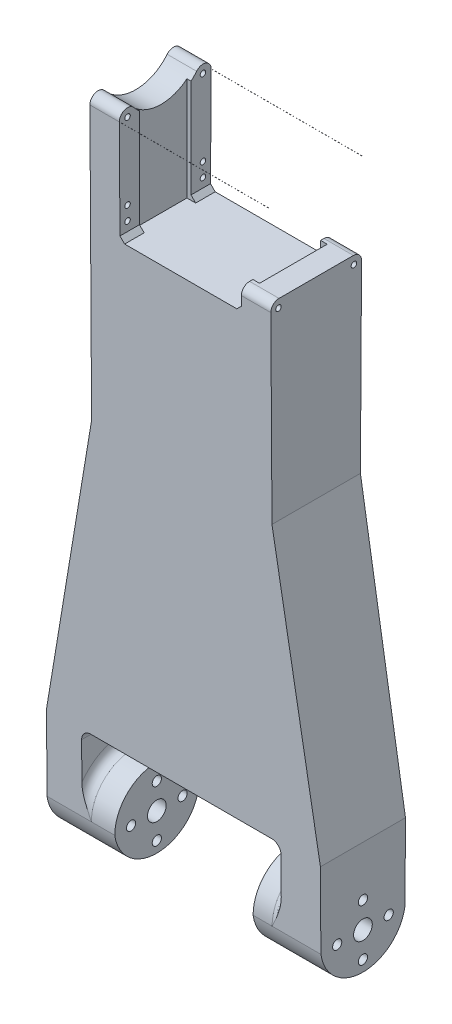
from build123d import *

# Parameters (mm, degrees)
BOSS_EXTRUDE1_DEPTH             = 24.511
BOSS_EXTRUDE1_DEPTH_BACK        = 24.511
CUT_EXTRUDE3_DEPTH              = 212.61733137029668
CUT_EXTRUDE3_DEPTH_BACK         = 212.61733137029668
SKETCH3_4_R                     = 1.250061000000001
SKETCH3_4_R_2                   = 1.2500610000000008
SKETCH3_4_R_3                   = 0.7500620000000013
SKETCH3_4_R_4                   = 0.7500620000000047
SKETCH3_4_R_5                   = 0.7500620000000029
SKETCH3_4_R_6                   = 2.5400000000000005
CUT_EXTRUDE4_DEPTH              = 18.796
CUT_EXTRUDE4_DEPTH_BACK         = 18.796
CUT_EXTRUDE5_DEPTH              = 16.51
CUT_EXTRUDE5_DEPTH_BACK         = 16.51
SKETCH4_4_W                     = 24.944915852009693
SKETCH4_4_H                     = 29.122471599999187
CUT_EXTRUDE6_DEPTH              = 18.200001699999998
CUT_EXTRUDE7_DEPTH              = 1.7999963999999997
CUT_EXTRUDE8_DEPTH              = 1.0999978
CUT_EXTRUDE10_DEPTH             = 212.61733137029668
CUT_EXTRUDE10_DEPTH_BACK        = 212.61733137029668
SKETCH7_R                       = 1.2500610000000012
SKETCH7_R_2                     = 1.2500610000000008
SKETCH7_R_3                     = 2.540000000000001
BOSS_EXTRUDE2_DEPTH             = 12.7
SKETCH8_W                       = 37.592
SKETCH8_H                       = 6.349999999999998
CUT_EXTRUDE11_DEPTH             = 8.093114
CUT_EXTRUDE12_DEPTH             = 45.289978
CUT_EXTRUDE12_DEPTH_BACK        = 8.889999999999999
BOSS_EXTRUDE8_REACH             = 215.461
BOSS_EXTRUDE8_DIRECTION_2_REACH = 215.461
FILLET2_R                       = 2.54
SKETCH15_R                      = 0.7500620000000063
CUT_EXTRUDE13_DEPTH             = 220.06782308598028
CUT_EXTRUDE14_DEPTH             = 10.922000000000002
CUT_EXTRUDE14_DEPTH_BACK        = 13.97
SKETCH16_W                      = 8.000999999999998
SKETCH16_H                      = 24.944915852009693
FILLET3_R                       = 2.2224999999999997
CUT_EXTRUDE16_DEPTH             = 1.3129259999999998
SKETCH18_W                      = 1.7999963999999977
SKETCH18_H                      = 18.39999999999989
CUT_EXTRUDE17_DEPTH             = 1.714821389
CHAMFER1_SIZE                   = 1.27


with BuildPart() as part:
    # Sketch3 → Boss-Extrude1 (new, two sides: drawn at the far end of the back side and taken through both)
    with BuildSketch(Plane(origin=(0, 0, 0), x_dir=(0, 0, -1), z_dir=(1, 0, 0)).offset(-BOSS_EXTRUDE1_DEPTH_BACK)):
        with BuildLine():
            Line((-11.429783892027034, 38.029713574858185), (-12.472457926005259, 207.58647868496024))
            ThreePointArc((-12.472457926005259, 207.58647868496024), (-10.998297041817699, 209.69288477315203), (-8.52275746267989, 208.99876611401845))
            ThreePointArc((-8.52275746267989, 208.99876611401845), (4.7735e-13, 204.93348624599832), (8.52275746267989, 208.99876611401845))
            ThreePointArc((8.52275746267989, 208.99876611401845), (10.9982970418177, 209.69288477315203), (12.472457926005257, 207.58647868496024))
            Line((12.472457926005257, 207.58647868496024), (11.429783892027034, 38.029713574858185))
            ThreePointArc((11.429783892027034, 38.029713574858185), (7e-16, 26.67000000000001), (-11.429783892027034, 38.029713574858185))
        make_face()
    extrude(amount=BOSS_EXTRUDE1_DEPTH + BOSS_EXTRUDE1_DEPTH_BACK)

    # Sketch3<4> → Cut-Extrude3 (cut, two sides: drawn at the far end of the back side and taken through both)
    with BuildSketch(Plane(origin=(0, 0, 0), x_dir=(0, 0, -1), z_dir=(1, 0, 0)).offset(-CUT_EXTRUDE3_DEPTH_BACK)):
        with Locations((0, 45.099986)):
            Circle(SKETCH3_4_R)
        with Locations((6.999986, 38.1)):
            Circle(SKETCH3_4_R_2)
        with Locations((8.7e-16, 31.100013999999994)):
            Circle(SKETCH3_4_R)
        with Locations((-6.999986, 38.099999999999994)):
            Circle(SKETCH3_4_R_2)
        with Locations((-10.249999947000001, 186.90016148984893)):
            Circle(SKETCH3_4_R_3)
        with Locations((10.249999947000001, 186.90016148984893)):
            Circle(SKETCH3_4_R_4)
        with Locations((10.249999947, 207.60014548984893)):
            Circle(SKETCH3_4_R_5)
        with Locations((-10.249999947, 207.60014548984893)):
            Circle(SKETCH3_4_R_5)
        with Locations((0, 38.1)):
            Circle(SKETCH3_4_R_6)
    extrude(amount=CUT_EXTRUDE3_DEPTH + CUT_EXTRUDE3_DEPTH_BACK, mode=Mode.SUBTRACT)

    # Sketch4 → Cut-Extrude4 (cut, two sides: drawn at the far end of the back side and taken through both)
    with BuildSketch(Plane(origin=(0, 0, 0), x_dir=(0, 0, -1), z_dir=(1, 0, 0)).offset(-CUT_EXTRUDE4_DEPTH_BACK)):
        Polygon((11.507083734629324, 50.60000000000001), (11.507083734629328, 26.670000000000005), (-11.507083734629262, 26.670000000000005), (-11.507083734629266, 50.60000000000001), align=None)
    extrude(amount=CUT_EXTRUDE4_DEPTH + CUT_EXTRUDE4_DEPTH_BACK, mode=Mode.SUBTRACT)

    # Sketch4<4> → Cut-Extrude5 (cut, two sides: drawn at the far end of the back side and taken through both)
    with BuildSketch(Plane(origin=(0, 0, 0), x_dir=(0, 0, -1), z_dir=(1, 0, 0)).offset(-CUT_EXTRUDE5_DEPTH_BACK)):
        with Locations((4.0767e-13, 195.2614096898485)):
            Rectangle(SKETCH4_4_W, SKETCH4_4_H)
    extrude(amount=CUT_EXTRUDE5_DEPTH + CUT_EXTRUDE5_DEPTH_BACK, mode=Mode.SUBTRACT)

    # Sketch5 → Cut-Extrude6 (cut)
    with BuildSketch(Plane.ZY.offset(-16.51)):
        Polygon((-10.099999946999949, 204.35014548984893), (10.100000053000075, 204.35014548984918), (10.10000005300013, 199.35014548984913), (-10.099999946999894, 199.35014548984896), align=None)
    extrude(amount=-CUT_EXTRUDE6_DEPTH, mode=Mode.SUBTRACT)

    # Sketch5<3> → Cut-Extrude7 (cut)
    with BuildSketch(Plane.ZY.offset(-16.51)):
        Polygon((9.200000053000117, 199.35014548984913), (-9.19999994699991, 199.35014548984896), (-9.199999946999771, 181.10206927849566), (9.200000053000117, 181.10206927849586), align=None)
        with BuildLine():
            ThreePointArc((-8.522757462679255, 208.998766114019), (-8.648059388577664, 209.1406949688589), (-8.7849860703008, 209.27144456274854))
            ThreePointArc((-8.784986070300787, 209.27144456274857), (-7.724991898042871, 208.0617683284812), (-6.499999946999959, 207.01951166294623))
            Line((-6.4999999469999565, 207.01951166294623), (-6.499999946999929, 204.35014548984896))
            Line((-6.499999946999929, 204.35014548984898), (6.500000053000081, 204.35014548984913))
            Line((6.5000000530000825, 204.35014548984915), (6.500000053000054, 207.01951177801337))
            ThreePointArc((6.500000053000056, 207.01951177801337), (7.724991926184506, 208.06176838210936), (8.784986039783028, 209.27144453599774))
            ThreePointArc((8.784986039783035, 209.27144453599774), (8.648059374512448, 209.14069495423342), (8.522757462679118, 208.9987661140191))
            ThreePointArc((8.52275746267912, 208.9987661140191), (-4.352e-14, 204.93348624599935), (-8.52275746267926, 208.998766114019))
        make_face()
        with BuildLine():
            ThreePointArc((-8.7849860703008, 209.27144456274854), (-8.984301764749219, 209.42703201107662), (-9.19999994699976, 209.55897326430892))
            Line((-9.199999946999784, 209.55897326430892), (-9.199999946999847, 204.35014548984893))
            Line((-9.199999946999847, 204.35014548984893), (-6.499999946999929, 204.35014548984896))
            Line((-6.499999946999929, 204.35014548984896), (-6.4999999469999565, 207.01951166294623))
            ThreePointArc((-6.499999946999959, 207.01951166294623), (-7.724991898042871, 208.0617683284812), (-8.784986070300787, 209.27144456274857))
        make_face()
        with BuildLine():
            Line((6.500000053000054, 207.01951177801337), (6.5000000530000825, 204.35014548984915))
            Line((6.5000000530000825, 204.35014548984915), (9.20000005300018, 204.35014548984918))
            Line((9.20000005300018, 204.35014548984918), (9.200000053000243, 209.55897332112895))
            ThreePointArc((9.20000005300017, 209.55897332112897), (8.98430179750009, 209.42703203376715), (8.784986039783035, 209.27144453599774))
            ThreePointArc((8.784986039783028, 209.27144453599774), (7.724991926184506, 208.06176838210936), (6.500000053000056, 207.01951177801337))
        make_face()
    extrude(amount=-CUT_EXTRUDE7_DEPTH, mode=Mode.SUBTRACT)

    # Sketch6 → Cut-Extrude8 (cut)
    with BuildSketch(Plane(origin=(-16.51, 0, 0), x_dir=(0, 0, -1), z_dir=(1, 0, 0))):
        Polygon((6.999998699999999, 180.7001738898489), (-6.999998699999999, 180.7001738898489), (-6.9999987, 209.82264548984818), (6.9999987, 209.82264548984818), align=None)
    extrude(amount=-CUT_EXTRUDE8_DEPTH, mode=Mode.SUBTRACT)

    # Sketch3<5> → Cut-Extrude10 (cut, two sides: drawn at the far end of the back side and taken through both)
    with BuildSketch(Plane(origin=(0, 0, 0), x_dir=(0, 0, -1), z_dir=(1, 0, 0)).offset(-CUT_EXTRUDE10_DEPTH_BACK)):
        with BuildLine():
            ThreePointArc((-11.429783892027034, 38.029713574858185), (7e-16, 26.67000000000001), (11.429783892027034, 38.029713574858185))
            ThreePointArc((11.429783892027034, 38.029713574858185), (3.03e-15, 28.100020000036405), (-11.429783892027034, 38.029713574858185))
        make_face()
    extrude(amount=CUT_EXTRUDE10_DEPTH + CUT_EXTRUDE10_DEPTH_BACK, mode=Mode.SUBTRACT)

    # Sketch7 → Boss-Extrude2 (add)
    with BuildSketch(Plane(origin=(24.511, 0, 0), x_dir=(0, 0, -1), z_dir=(1, 0, 0))):
        with BuildLine():
            Line((-11.429783892027034, 38.02971357485818), (-11.556851609732457, 58.693114083501726))
            Line((-11.556851609732457, 58.693114083501726), (11.556851609732457, 58.693114083501726))
            Line((11.556851609732457, 58.693114083501726), (11.429783892027036, 38.02971357485818))
            ThreePointArc((11.429783892027036, 38.02971357485818), (3.03e-15, 28.1000200000364), (-11.429783892027034, 38.02971357485818))
        make_face()
        with Locations((8.7e-16, 31.100013999999994)):
            Circle(SKETCH7_R, mode=Mode.SUBTRACT)
        with Locations((6.999986, 38.1)):
            Circle(SKETCH7_R_2, mode=Mode.SUBTRACT)
        with Locations((0, 45.099986)):
            Circle(SKETCH7_R, mode=Mode.SUBTRACT)
        with Locations((0, 38.1)):
            Circle(SKETCH7_R_3, mode=Mode.SUBTRACT)
        with Locations((-6.999986, 38.099999999999994)):
            Circle(SKETCH7_R_2, mode=Mode.SUBTRACT)
    boss_extrude2 = extrude(amount=BOSS_EXTRUDE2_DEPTH)

    # Sketch8 → Cut-Extrude11 (cut)
    with BuildSketch(Plane.XZ.offset(-50.60000000000001)):
        with Locations((0, 14.682083734629265)):
            Rectangle(SKETCH8_W, SKETCH8_H)
        Polygon((18.796, 11.507083734629266), (-18.796, 11.507083734629266), (-18.796, -11.429783892027036), (18.200001699999994, -11.429783892027036), (18.200001699999998, -11.507083734629324), (18.796, -11.507083734629324), align=None)
        Polygon((18.200001699999994, -11.429783892027036), (-18.796, -11.429783892027036), (-18.796, -11.507083734629322), (18.200001699999994, -11.507083734629324), align=None)
        Polygon((18.200001699999994, -11.507083734629324), (-18.796, -11.507083734629324), (-18.795999999999996, -17.779783892027037), (18.200001699999998, -17.779783892027037), align=None)
    extrude(amount=-CUT_EXTRUDE11_DEPTH, mode=Mode.SUBTRACT)

    # Mirror1: Boss-Extrude2 across plane
    add(boss_extrude2.mirror(Plane(origin=(0, 0, 0), x_dir=(0, 0, 1), z_dir=(1, 0, 0))))

    # Sketch11 → Cut-Extrude12 (cut, two sides: drawn at the far end of the back side and taken through both)
    with BuildSketch(Plane(origin=(-18.796, 0, 0), x_dir=(0, 0, -1), z_dir=(1, 0, 0)).offset(-CUT_EXTRUDE12_DEPTH_BACK)):
        with BuildLine():
            ThreePointArc((-11.429783892027034, 38.02971357485818), (-2.1e-15, 49.529999999999994), (11.429783892027036, 38.02971357485818))
            Line((11.429783892027036, 38.02971357485818), (11.556851609732457, 58.693114083501726))
            Line((11.556851609732457, 58.693114083501726), (-11.556851609732457, 58.693114083501726))
            Line((-11.556851609732457, 58.693114083501726), (-11.429783892027034, 38.02971357485818))
        make_face()
    extrude(amount=CUT_EXTRUDE12_DEPTH + CUT_EXTRUDE12_DEPTH_BACK, mode=Mode.SUBTRACT)


with BuildPart() as cut_extrude12_piece_1:
    # of the separate pieces the step leaves, piece 1, a body of its own (cut_extrude12_pieces)
    add(part.part.solids().sort_by_distance((-24.511, 207.586478685, -12.472457926))[0])


with BuildPart() as cut_extrude12_piece_2:
    # of the separate pieces the step leaves, piece 2, a body of its own (cut_extrude12_pieces)
    add(part.part.solids().sort_by_distance((37.211, 38.029713575, -11.429783892))[0])



with BuildPart() as cut_extrude12_piece_3:
    # of the separate pieces the step leaves, piece 3, a body of its own (cut_extrude12_pieces)
    add(part.part.solids().sort_by_distance((-27.686, 58.693114084, -11.55685161))[0])


with BuildPart() as cut_extrude12_piece_2_1:
    add(cut_extrude12_piece_2.part)

    add(cut_extrude12_piece_3.part)  # Boss-Extrude8 merges Cut-Extrude12 piece 3
    # Boss-Extrude8: up to this plane
    boss_extrude8_end = Plane(origin=(-24.511, 38.029713574858185, 11.429783892027034), z_dir=(0, 0.006149293538216357, -0.9999810929157515))
    # Sketch14 → Boss-Extrude8 (add, up to the surface)
    with BuildSketch(Plane.XY, mode=Mode.PRIVATE) as boss_extrude8_sk1:
        Polygon((-24.511, 133.13979638423098), (-37.21099999999999, 58.693114083501726), (-24.511, 58.693114083501726), align=None)
    boss_extrude8_tool1 = split(extrude(boss_extrude8_sk1.sketch, amount=BOSS_EXTRUDE8_REACH, mode=Mode.PRIVATE), bisect_by=boss_extrude8_end, keep=Keep.BOTH, mode=Mode.PRIVATE)
    add(boss_extrude8_tool1.solids().sort_by_distance((-28.744333, 83.508675, 0))[0])
    # Sketch14 → Boss-Extrude8 (add, up to the surface)
    with BuildSketch(Plane.XY, mode=Mode.PRIVATE) as boss_extrude8_sk2:
        Polygon((24.511, 133.13979638423098), (24.511, 58.693114083501726), (37.21099999999999, 58.693114083501726), align=None)
    boss_extrude8_tool2 = split(extrude(boss_extrude8_sk2.sketch, amount=BOSS_EXTRUDE8_REACH, mode=Mode.PRIVATE), bisect_by=boss_extrude8_end, keep=Keep.BOTH, mode=Mode.PRIVATE)
    add(boss_extrude8_tool2.solids().sort_by_distance((28.744333, 83.508675, 0))[0])

    # Boss-Extrude8 direction 2: up to this plane
    boss_extrude8_direction_2_end = Plane(origin=(-24.511, 207.58647868496024, -12.472457926005257), z_dir=(0, 0.006149293538216346, 0.9999810929157515))
    # Sketch14 → Boss-Extrude8 direction 2 (add, up to the surface)
    with BuildSketch(Plane.XY, mode=Mode.PRIVATE) as boss_extrude8_direction_2_sk1:
        Polygon((-24.511, 133.13979638423098), (-37.21099999999999, 58.693114083501726), (-24.511, 58.693114083501726), align=None)
    boss_extrude8_direction_2_tool1 = split(extrude(boss_extrude8_direction_2_sk1.sketch, amount=-BOSS_EXTRUDE8_DIRECTION_2_REACH, mode=Mode.PRIVATE), bisect_by=boss_extrude8_direction_2_end, keep=Keep.BOTH, mode=Mode.PRIVATE)
    add(boss_extrude8_direction_2_tool1.solids().sort_by_distance((-28.744333, 83.508675, 0))[0])
    # Sketch14 → Boss-Extrude8 direction 2 (add, up to the surface)
    with BuildSketch(Plane.XY, mode=Mode.PRIVATE) as boss_extrude8_direction_2_sk2:
        Polygon((24.511, 133.13979638423098), (24.511, 58.693114083501726), (37.21099999999999, 58.693114083501726), align=None)
    boss_extrude8_direction_2_tool2 = split(extrude(boss_extrude8_direction_2_sk2.sketch, amount=-BOSS_EXTRUDE8_DIRECTION_2_REACH, mode=Mode.PRIVATE), bisect_by=boss_extrude8_direction_2_end, keep=Keep.BOTH, mode=Mode.PRIVATE)
    add(boss_extrude8_direction_2_tool2.solids().sort_by_distance((28.744333, 83.508675, 0))[0])

    # Combine2: union Cut-Extrude12 piece 1
    add(cut_extrude12_piece_1.part)

    # Fillet2
    fillet2_edges = [cut_extrude12_piece_2_1.edges().sort_by_distance(p)[0] for p in [
        (-27.686, 49.529999999999994, 4.6e-16),
        (-27.686, 58.693114083501726, 0),
        (26.493978, 58.693114083501726, 0),
        (26.493978, 49.529999999999994, 4.6e-16),
    ]]
    fillet(fillet2_edges, radius=FILLET2_R)

    # Sketch15 → Cut-Extrude13 (cut, through all)
    with BuildSketch(Plane(origin=(24.511, 0, 0), x_dir=(0, 0, -1), z_dir=(1, 0, 0))):
        with Locations((-10.249999947000001, 183.15010548984893)):
            Circle(SKETCH15_R)
        with Locations((10.249999947000001, 183.15010548984893)):
            Circle(SKETCH15_R)
    extrude(amount=-CUT_EXTRUDE13_DEPTH, mode=Mode.SUBTRACT)

    # Sketch16 → Cut-Extrude14 (cut, two sides: drawn at the far end of the back side and taken through both)
    with BuildSketch(Plane(origin=(0, 199.35014548984904, -1.64349e-12), x_dir=(1, 0, 0), z_dir=(0, 1, -8.24e-15)).offset(-CUT_EXTRUDE14_DEPTH_BACK)):
        with Locations((20.510500000000004, -1.30118e-12)):
            Rectangle(SKETCH16_W, SKETCH16_H)
    extrude(amount=CUT_EXTRUDE14_DEPTH + CUT_EXTRUDE14_DEPTH_BACK, mode=Mode.SUBTRACT)

    # Fillet3
    fillet3_edges = [cut_extrude12_piece_2_1.edges().sort_by_distance(p)[0] for p in [
        (20.5105, 185.38014548984916, 12.335902082908255),
        (20.5105, 185.38014548984893, -12.33590208290825),
    ]]
    fillet(fillet3_edges, radius=FILLET3_R)

    # Sketch17 → Cut-Extrude16 (cut)
    with BuildSketch(Plane(origin=(0, 180.7001738898489, 0), x_dir=(1, 0, 0), z_dir=(0, 1, 0))):
        Polygon((-16.51, -12.30712301966116), (16.510000000000005, -12.30712301966116), (16.510000000000005, 12.307123019661159), (-16.51, 12.307123019661159), (-16.51, 6.999998699999999), (-17.6099978, 6.999998699999999), (-17.6099978, -6.999998699999999), (-16.51, -6.999998699999999), align=None)
    extrude(amount=-CUT_EXTRUDE16_DEPTH, mode=Mode.SUBTRACT)

    # Sketch18 → Cut-Extrude17 (cut)
    with BuildSketch(Plane(origin=(0, 181.10206927849575, -1.8319e-12), x_dir=(1, 0, 0), z_dir=(0, 1, -1.012e-14))):
        with Locations((17.4099982, -5.300200634e-08)):
            Rectangle(SKETCH18_W, SKETCH18_H)
    extrude(amount=-CUT_EXTRUDE17_DEPTH, mode=Mode.SUBTRACT)

    # Chamfer1
    chamfer1_edges = [cut_extrude12_piece_2_1.edges().sort_by_distance(p)[0] for p in [
        (-16.51, 179.3872478898489, 9.64952399982135),
        (-16.51, 179.3872478898489, -9.649523999821348),
        (16.510000000000005, 179.3872478898489, 10.749524676321418),
        (16.510000000000005, 179.3872478898489, -10.749524623321227),
    ]]
    chamfer(chamfer1_edges, length=CHAMFER1_SIZE)


solid = cut_extrude12_piece_2_1.part
